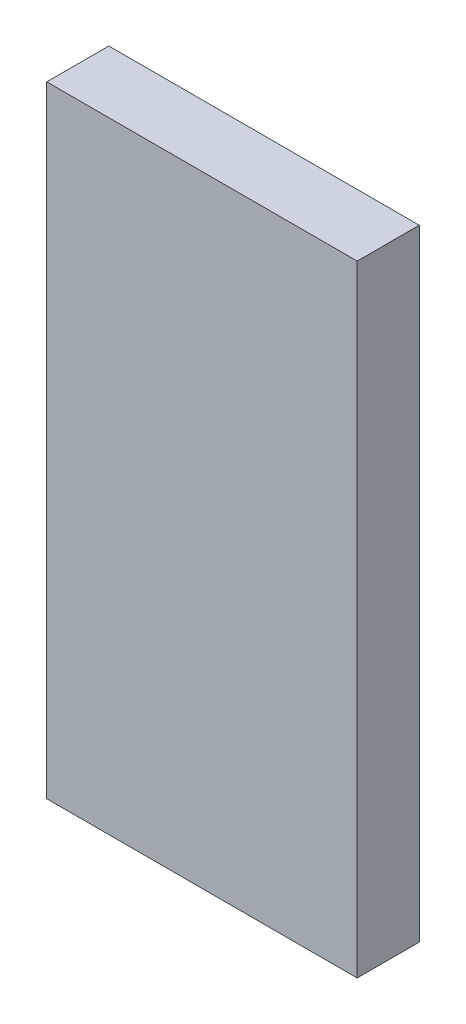
from build123d import *

# Parameters (mm, degrees)
SKETCH1_W               = 40
SKETCH1_H               = 80
BOSS_EXTRUDE1_DEPTH     = 8
CUT_EXTRUDE_THIN1_DEPTH = 6
SKETCH2_W               = 6
SKETCH2_H               = 36.769552622
CUT_EXTRUDE1_DEPTH      = 3


with BuildPart() as part:
    # Sketch1 → Boss-Extrude1 (new body)
    with BuildSketch(Plane.XY):
        with Locations((-83.02277118, 5.318441745)):
            Rectangle(SKETCH1_W, SKETCH1_H)
    extrude(amount=BOSS_EXTRUDE1_DEPTH)

    # Sketch1<4> → Cut-Extrude-Thin1 (cut)
    with BuildSketch(Plane.XY):
        Polygon((-97.012604353, 32.561082432), (-97.012604353, -17.681558255), (-71.012604353, -17.681558255), (-71.012604353, 6.561082432), align=None)
        Polygon((-91.012604353, 18.075801058), (-91.012604353, -11.681558255), (-77.012604353, -11.681558255), (-77.012604353, 4.075801058), align=None, mode=Mode.SUBTRACT)
    extrude(amount=CUT_EXTRUDE_THIN1_DEPTH, mode=Mode.SUBTRACT)

    # Sketch2 → Cut-Extrude1 (cut)
    with BuildSketch(Plane(origin=(-32.22576096, -32.22576096, 0), x_dir=(0, 0, 1), z_dir=(-0.7071067811865461, -0.707106781186549, 0))):
        with Locations((3, 73.237656278)):
            Rectangle(SKETCH2_W, SKETCH2_H)
    extrude(amount=-CUT_EXTRUDE1_DEPTH, mode=Mode.SUBTRACT)


solid = part.part
